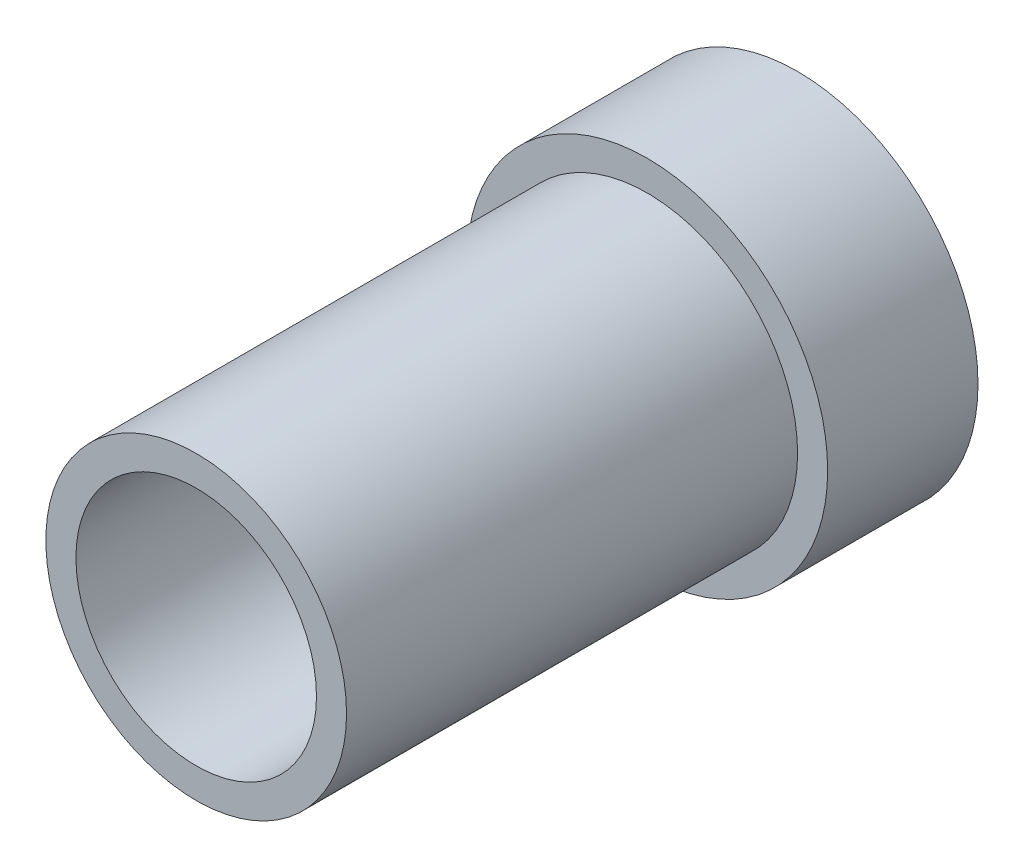
from build123d import *

# Parameters (mm, degrees)
CROQUIS1_R              = 1
CROQUIS1_R_2            = 0.8
SALIENTE_EXTRUIR1_DEPTH = 3
CROQUIS1_3_R            = 1.2
SALIENTE_EXTRUIR2_DEPTH = 1


with BuildPart() as part:
    # Croquis1 → Saliente-Extruir1 (new body)
    with BuildSketch(Plane.XY):
        Circle(CROQUIS1_R)
        Circle(CROQUIS1_R_2, mode=Mode.SUBTRACT)
    extrude(amount=SALIENTE_EXTRUIR1_DEPTH)

    # Croquis1<3> → Saliente-Extruir2 (add)
    with BuildSketch(Plane.XY):
        Circle(CROQUIS1_3_R)
    extrude(amount=-SALIENTE_EXTRUIR2_DEPTH)


solid = part.part
